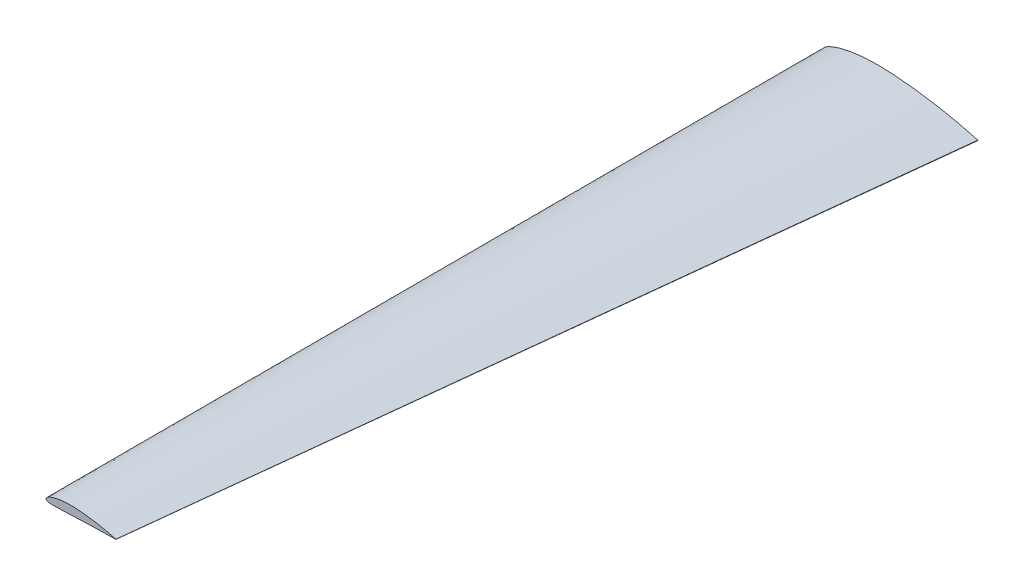
from build123d import *


with BuildPart() as part:
    # Sketch2 for Loft1 → Loft1 section 0
    with BuildSketch(Plane.XY.offset(500)):
        with BuildLine():
            # circular arc as an exact rational Bezier (weights 1, cos(half-angle), 1)
            Bezier((44.999999916, 0.0585), (45.218011137, 0), (44.999999916, -0.0585), weights=[1, 0.259166523, 1])
            add(Edge.make_bspline(
                [(44.999999916, 0.0585), (44.250773182, 0.262456435), (42.755935382, 0.669385039), (39.761341997, 1.40928162), (36.016499759, 2.22677735), (31.512166398, 3.032632576), (27.011324898, 3.693182883), (22.507975569, 4.164353059), (18.005018622, 4.458217343), (14.245896075, 4.461189337), (11.244449368, 4.253539272), (8.990322945, 3.980026753), (6.731324744, 3.576675146), (4.859372551, 3.091587627), (3.359278701, 2.601669439), (2.228173261, 2.139164026), (1.263052468, 1.638976637), (0.425326829, 1.040664313), (-0.303918779, 0.078388768), (0.483205893, -0.657539781), (1.286388798, -0.946419104), (2.242924401, -1.141399927), (3.372590577, -1.240533637), (4.874376312, -1.310692515), (6.750469603, -1.305437567), (9.00097655, -1.242460866), (11.249895553, -1.122548998), (14.24990731, -0.982240654), (17.999281608, -0.802187252), (22.500129741, -0.633115703), (26.999531996, -0.44537616), (31.499364778, -0.28547021), (35.999558053, -0.167849351), (39.749887316, -0.108129858), (42.749931523, -0.068801486), (44.249990618, -0.061933767), (44.999999916, -0.0585)],
                knots=[0, 0, 0, 0, 0.025304886, 0.050487653, 0.100520433, 0.150190716, 0.199586607, 0.248740009, 0.297715539, 0.346600594, 0.371102737, 0.395726297, 0.420570145, 0.445825119, 0.458702216, 0.471919982, 0.485786003, 0.493461051, 0.506863029, 0.51614777, 0.522766003, 0.535269014, 0.547551134, 0.559786371, 0.584228898, 0.60868081, 0.633151284, 0.657621757, 0.706558114, 0.75548187, 0.804405627, 0.853320224, 0.902221408, 0.951113136, 0.975557228, 1, 1, 1, 1], degree=3))
        make_face()
    # Sketch1 for Loft1 → Loft1 section 1
    with BuildSketch(Plane.XY):
        with BuildLine():
            Bezier((100.04096197, 0.130053251), (100.459155973, 0), (100.04096197, -0.130053251), weights=[1, 0.29695923, 1])
            add(Edge.make_bspline(
                [(100.04096197, 0.130053251), (98.375331673, 0.583475429), (95.05210919, 1.48813163), (88.394731334, 3.133019761), (80.069450875, 4.95042108), (70.055721025, 6.741944018), (60.049754043, 8.210434867), (50.038211826, 9.257908596), (40.027541925, 9.911207834), (31.670514448, 9.91781497), (24.997900748, 9.456181362), (19.986679057, 8.848126795), (14.964626755, 7.951422733), (10.803029011, 6.873008906), (7.468121632, 5.783855864), (4.953524376, 4.755645054), (2.807932982, 3.643662215), (0.945557892, 2.313534648), (-0.675651712, 0.174268617), (1.074230721, -1.461798052), (2.859812736, -2.104015061), (4.986318113, -2.537483265), (7.497715695, -2.757870636), (10.836384359, -2.913843118), (15.007188314, -2.902160673), (20.01036343, -2.762155121), (25.01000834, -2.495575151), (31.679431955, -2.183651112), (40.014787783, -1.783368545), (50.02076951, -1.40750009), (60.023536859, -0.990130213), (70.027261326, -0.634638099), (80.031787218, -0.373151346), (88.369266059, -0.240387), (95.038761815, -0.152954819), (98.373591929, -0.137686969), (100.04096197, -0.130053251)],
                knots=[0, 0, 0, 0, 0.025304886, 0.050487653, 0.100520433, 0.150190716, 0.199586607, 0.248740009, 0.297715539, 0.346600594, 0.371102737, 0.395726297, 0.420570145, 0.445825119, 0.458702216, 0.471919982, 0.485786003, 0.493461051, 0.506863029, 0.51614777, 0.522766003, 0.535269014, 0.547551134, 0.559786371, 0.584228898, 0.60868081, 0.633151284, 0.657621757, 0.706558114, 0.75548187, 0.804405627, 0.853320224, 0.902221408, 0.951113136, 0.975557228, 1, 1, 1, 1], degree=3))
        make_face()
    loft()


solid = part.part
